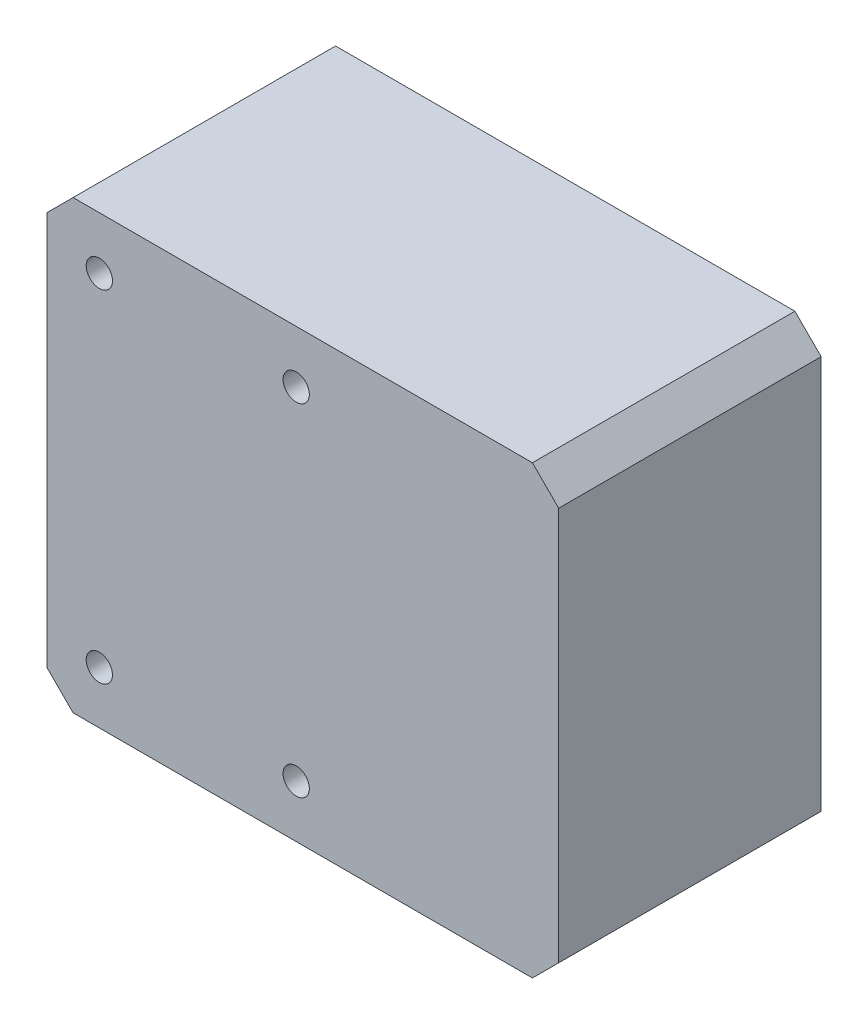
from build123d import *

# Parameters (mm, degrees)
SKETCH_1_W      = 195
SKETCH_1_H      = 170
SKETCH_1_R      = 5
EXTRUDE_1_DEPTH = 100
CHAMFER_1_SIZE  = 10


with BuildPart() as part:
    # 草图1 → 凸台-拉伸1 (new body)
    with BuildSketch(Plane.XY):
        with Locations((40, 0)):
            Rectangle(SKETCH_1_W, SKETCH_1_H)
        with Locations((-37.5, 65)):
            Circle(SKETCH_1_R, mode=Mode.SUBTRACT)
        with Locations((37.5, 65)):
            Circle(SKETCH_1_R, mode=Mode.SUBTRACT)
        with Locations((-37.5, -65)):
            Circle(SKETCH_1_R, mode=Mode.SUBTRACT)
        with Locations((37.5, -65)):
            Circle(SKETCH_1_R, mode=Mode.SUBTRACT)
    extrude(amount=EXTRUDE_1_DEPTH)

    # 倒角1
    chamfer_1_edges = [part.edges().sort_by_distance(p)[0] for p in [
        (137.5, -85, 50),
        (-57.5, -85, 50),
        (-57.5, 85, 50),
        (137.5, 85, 50),
    ]]
    chamfer(chamfer_1_edges, length=CHAMFER_1_SIZE)


solid = part.part
